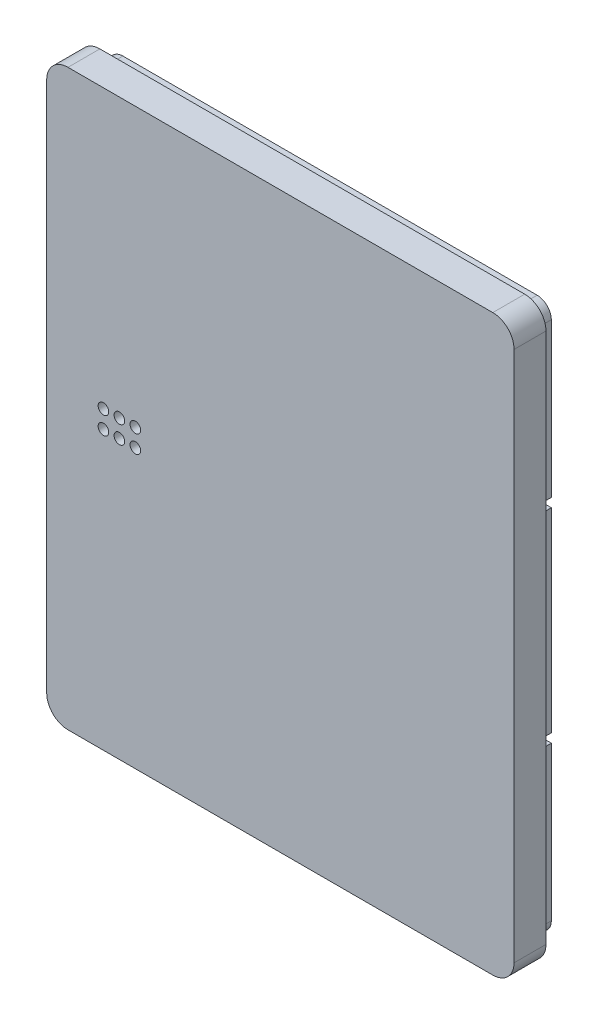
from build123d import *

# Parameters (mm, degrees)
CROQUIS1_W              = 131.8
CROQUIS1_H              = 161.8
SALIENTE_EXTRUIR1_DEPTH = 9
CROQUIS2_W              = 124.8
CROQUIS2_H              = 154.8
SALIENTE_EXTRUIR2_DEPTH = 5
CROQUIS4_W              = 120.8
CROQUIS4_H              = 150.8
CORTAR_EXTRUIR1_DEPTH   = 10
REDONDEO1_R             = 4
REDONDEO2_R             = 2
REDONDEO3_R             = 4
REDONDEO4_R             = 4
REDONDEO5_R             = 2
REDONDEO6_R             = 4
REDONDEO7_R             = 2
REDONDEO8_R             = 6
CROQUIS9_W              = 124.8
CROQUIS9_H              = 2.5
CORTAR_EXTRUIR3_DEPTH   = 5
CROQUIS11_R             = 1.5
CORTAR_EXTRUIR6_DEPTH   = 9


with BuildPart() as part:
    # Croquis1 → Saliente-Extruir1 (new body)
    with BuildSketch(Plane.XY):
        with Locations((65.9, -80.9)):
            Rectangle(CROQUIS1_W, CROQUIS1_H)
    extrude(amount=SALIENTE_EXTRUIR1_DEPTH)

    # Croquis2 → Saliente-Extruir2 (add)
    with BuildSketch(Plane(origin=(0, 0, 0), x_dir=(-1, 0, 0), z_dir=(0, 0, -1))):
        with Locations((-65.9, -80.9)):
            Rectangle(CROQUIS2_W, CROQUIS2_H)
    extrude(amount=SALIENTE_EXTRUIR2_DEPTH)

    # Croquis4 → Cortar-Extruir1 (cut)
    with BuildSketch(Plane(origin=(0, 0, -5), x_dir=(-1, 0, 0), z_dir=(0, 0, -1))):
        with Locations((-65.9, -80.9)):
            Rectangle(CROQUIS4_W, CROQUIS4_H)
    extrude(amount=-CORTAR_EXTRUIR1_DEPTH, mode=Mode.SUBTRACT)

    # Redondeo1
    redondeo1_edges = [part.edges().sort_by_distance(p)[0] for p in [
        (128.3, -3.5, -2.5),
    ]]
    fillet(redondeo1_edges, radius=REDONDEO1_R)

    # Redondeo2
    redondeo2_edges = [part.edges().sort_by_distance(p)[0] for p in [
        (5.5, -5.5, 0),
    ]]
    fillet(redondeo2_edges, radius=REDONDEO2_R)

    # Redondeo3
    redondeo3_edges = [part.edges().sort_by_distance(p)[0] for p in [
        (3.5, -3.5, -2.5),
    ]]
    fillet(redondeo3_edges, radius=REDONDEO3_R)

    # Redondeo4
    redondeo4_edges = [part.edges().sort_by_distance(p)[0] for p in [
        (3.5, -158.3, -2.5),
    ]]
    fillet(redondeo4_edges, radius=REDONDEO4_R)

    # Redondeo5
    redondeo5_edges = [part.edges().sort_by_distance(p)[0] for p in [
        (5.5, -156.3, 0),
    ]]
    fillet(redondeo5_edges, radius=REDONDEO5_R)

    # Redondeo6
    redondeo6_edges = [part.edges().sort_by_distance(p)[0] for p in [
        (128.3, -158.3, -2.5),
    ]]
    fillet(redondeo6_edges, radius=REDONDEO6_R)

    # Redondeo7
    redondeo7_edges = [part.edges().sort_by_distance(p)[0] for p in [
        (126.3, -156.3, 0),
        (126.3, -5.5, 0),
    ]]
    fillet(redondeo7_edges, radius=REDONDEO7_R)

    # Redondeo8
    redondeo8_edges = [part.edges().sort_by_distance(p)[0] for p in [
        (0, 0, 4.5),
        (131.8, 0, 4.5),
        (131.8, -161.8, 4.5),
        (0, -161.8, 4.5),
    ]]
    fillet(redondeo8_edges, radius=REDONDEO8_R)

    # Croquis9 → Cortar-Extruir3 (cut)
    with BuildSketch(Plane(origin=(0, 0, -5), x_dir=(-1, 0, 0), z_dir=(0, 0, -1))):
        with Locations((-65.9, -52.15)):
            Rectangle(CROQUIS9_W, CROQUIS9_H)
        with Locations((-65.9, -109.65)):
            Rectangle(CROQUIS9_W, CROQUIS9_H)
    extrude(amount=-CORTAR_EXTRUIR3_DEPTH, mode=Mode.SUBTRACT)

    # Croquis11 → Cortar-Extruir6 (cut)
    with BuildSketch(Plane(origin=(0, 0, 5), x_dir=(-1, 0, 0), z_dir=(0, 0, -1))):
        with Locations((-25, -78.4)):
            Circle(CROQUIS11_R)
        with Locations((-25, -83.4)):
            Circle(CROQUIS11_R)
        with Locations((-20.5, -83.4)):
            Circle(CROQUIS11_R)
        with Locations((-16, -83.4)):
            Circle(CROQUIS11_R)
        with Locations((-20.5, -78.4)):
            Circle(CROQUIS11_R)
        with Locations((-16, -78.4)):
            Circle(CROQUIS11_R)
    extrude(amount=-CORTAR_EXTRUIR6_DEPTH, mode=Mode.SUBTRACT)


solid = part.part
